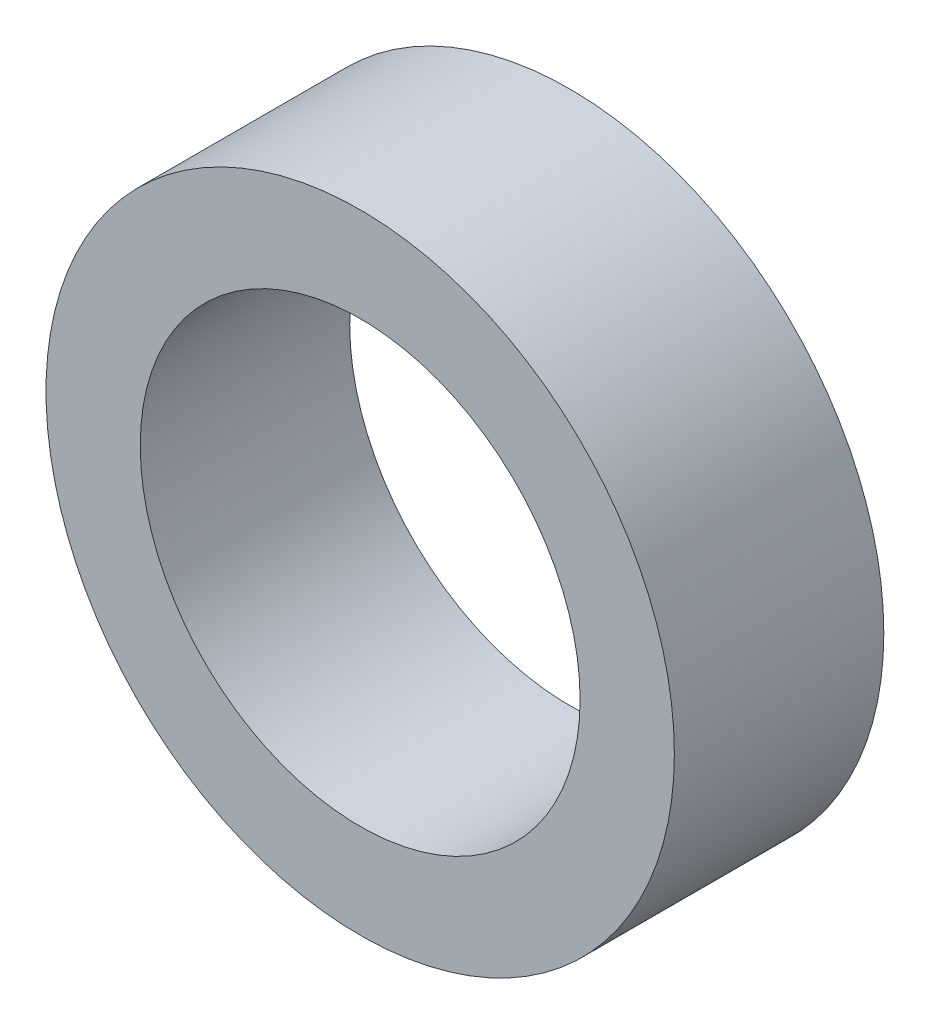
from build123d import *

# Parameters (mm, degrees)
SKETCH_1_R      = 3
SKETCH_1_R_2    = 2.1
EXTRUDE_1_DEPTH = 2


with BuildPart() as part:
    # 草图1 → 凸台-拉伸1 (new body)
    with BuildSketch(Plane.XY):
        Circle(SKETCH_1_R)
        Circle(SKETCH_1_R_2, mode=Mode.SUBTRACT)
    extrude(amount=EXTRUDE_1_DEPTH)


solid = part.part
